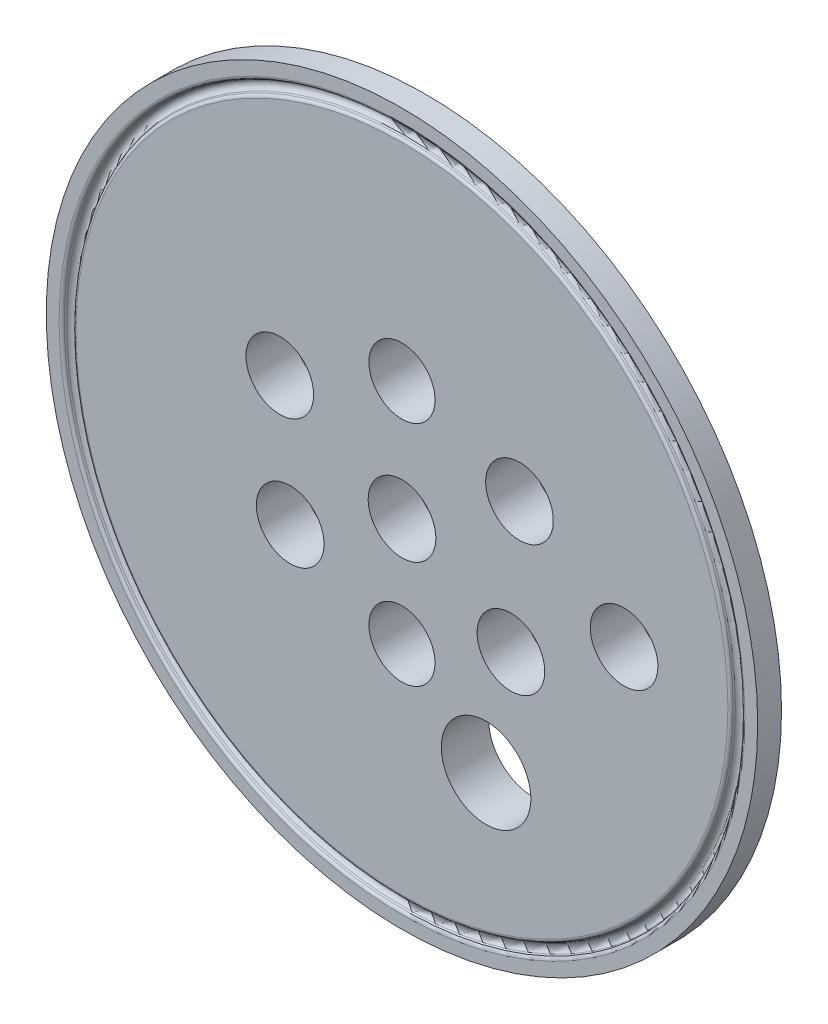
from build123d import *

# Parameters (mm, degrees)
SKETCH2_R          = 7.9375
SKETCH2_R_2        = 7.75
SKETCH2_R_3        = 10.5
CUT_EXTRUDE1_DEPTH = 119.521470637


with BuildPart() as part:
    # Sketch1 → Revolve1 (revolve)
    with BuildSketch(Plane(origin=(0, 0, 0), x_dir=(0, 0, -1), z_dir=(1, 0, 0)), mode=Mode.PRIVATE) as revolve1_sk:
        with BuildLine():
            Line((0, 0), (0, 76.444627725))
            ThreePointArc((0, 76.444627725), (0.130798304, 76.879222907), (0.479738309, 77.169433247))
            Line((0.479738309, 77.169433247), (0.872854821, 77.336301306))
            ThreePointArc((0.872854821, 77.336301306), (1.6002, 78.4352), (0.872854821, 79.534098694))
            Line((0.872854821, 79.534098694), (0.479738309, 79.700966753))
            ThreePointArc((0.479738309, 79.700966753), (0.130798304, 79.991177093), (0, 80.425772275))
            Line((0, 80.425772275), (0, 83.439))
            Line((0, 83.439), (5.588, 83.439))
            Line((5.588, 83.439), (11.0998, 68.295453959))
            Line((11.0998, 68.295453959), (11.0998, 0))
            Line((11.0998, 0), (0, 0))
        make_face()
    revolve(revolve1_sk.sketch.rotate(Axis((0, 0, 0), (0, 0, -1)), 90), axis=Axis((0, 0, 0), (0, 0, -1)))

    # Sketch2 → Cut-Extrude1 (cut, through all)
    with BuildSketch(Plane(origin=(0, 0, -11.0998), x_dir=(-1, 0, 0), z_dir=(0, 0, -1))):
        Circle(SKETCH2_R)
        with Locations((0, 27.9765569)):
            Circle(SKETCH2_R_2)
        with Locations((-25.552434697, -14.308394833)):
            Circle(SKETCH2_R)
        with Locations((-52.091958056, 0)):
            Circle(SKETCH2_R)
        with Locations((26.222693633, -14.308394833)):
            Circle(SKETCH2_R)
        with Locations((-27.556050936, 17.333644944)):
            Circle(SKETCH2_R)
        with Locations((28.655279996, 14.787165533)):
            Circle(SKETCH2_R)
        with Locations((0, -25.424326978)):
            Circle(SKETCH2_R_2)
        with Locations((-19.725243494, -41.754750634)):
            Circle(SKETCH2_R_3)
    extrude(amount=-CUT_EXTRUDE1_DEPTH, mode=Mode.SUBTRACT)


solid = part.part
